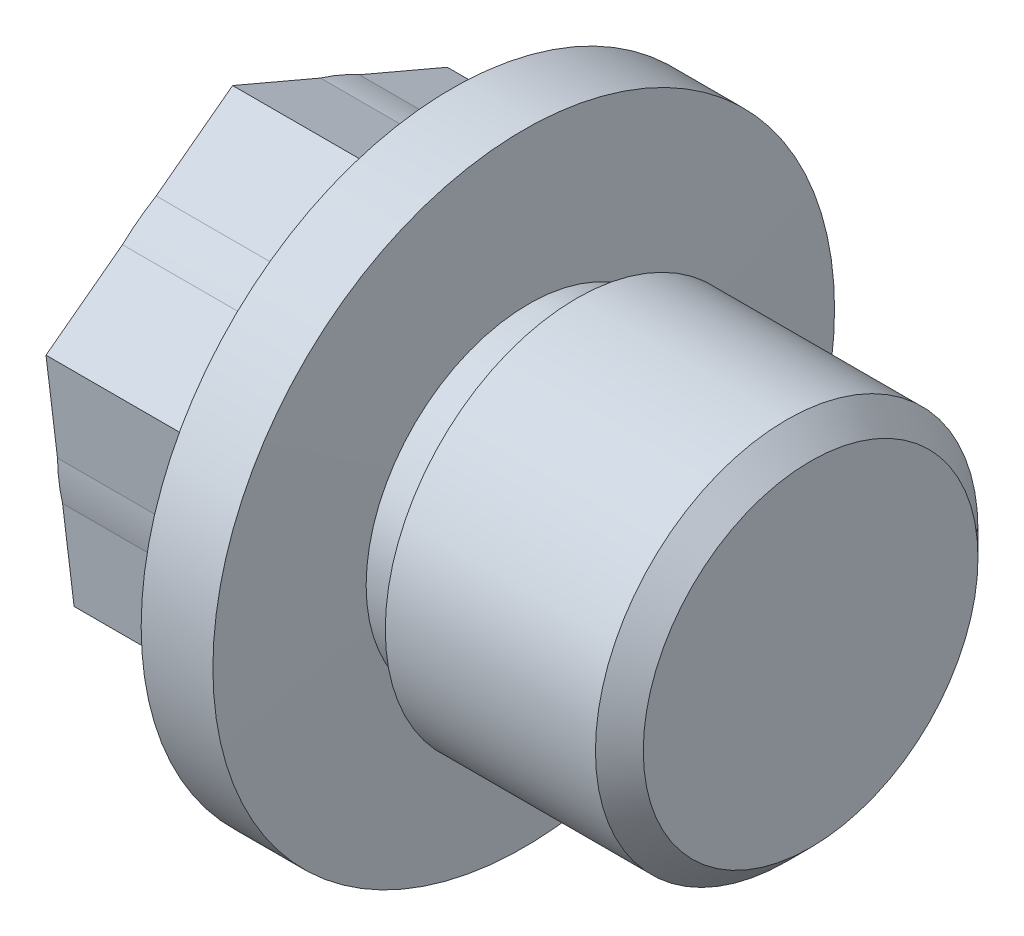
from build123d import *

# Parameters (mm, degrees)
EXTRUDE_START   = -8
SKETCH_2_R      = 8.5
EXTRUDE_1_DEPTH = 8
CHAMFER_1_SIZE  = 1


with BuildPart() as part:
    # Sketch 1 → 旋转1 (revolve)
    with BuildSketch(Plane.XY, mode=Mode.PRIVATE) as revolve_1_sk:
        Polygon((0, 0), (0, 8.5), (8, 8.5), (8, 13), (11, 13), (11.209265355, 6.8), (13.209265355, 6.8), (13.209265355, 8), (23, 8), (23, 0), align=None)
    revolve(revolve_1_sk.sketch.rotate(Axis((0, 0, 0), (1, 0, 0)), 90), axis=Axis((0, 0, 0), (1, 0, 0)))

    # 草图2 → 凸台-拉伸1 (add)
    # profile 1 of 7: a face of its own
    with BuildSketch(Plane.ZY.offset(EXTRUDE_START)):
        Polygon((-1.174764966, -9.690972033), (7.805245485, -5.86286232), (8.980010451, 3.828109713), (1.174764966, 9.690972033), (-7.805245485, 5.86286232), (-8.980010451, -3.828109713), align=None)
        Circle(SKETCH_2_R, mode=Mode.SUBTRACT)
    # profile 2 of 7: a face of its own
    with BuildSketch(Plane.ZY.offset(EXTRUDE_START)):
        with BuildLine():
            Line((-7.805245485, 5.86286232), (-8.286430908, 1.893426207))
            ThreePointArc((-8.286430908, 1.893426207), (-6.796266629, 5.104974035), (-4.12702026, 7.430861577))
            Line((-4.12702026, 7.430861577), (-7.805245485, 5.86286232))
        make_face()
    # profile 3 of 7: a face of its own
    with BuildSketch(Plane.ZY.offset(EXTRUDE_START)):
        with BuildLine():
            ThreePointArc((-2.503460259, 8.122972777), (1.022903886, 8.43822657), (4.371804767, 7.289535176))
            Line((4.371804767, 7.289535176), (1.174764966, 9.690972033))
            Line((1.174764966, 9.690972033), (-2.503460259, 8.122972777))
        make_face()
    # profile 4 of 7: a face of its own
    with BuildSketch(Plane.ZY.offset(EXTRUDE_START)):
        with BuildLine():
            ThreePointArc((8.5, 0), (8.499706252, -0.070665642), (8.498825028, -0.141326401))
            Line((8.498825028, -0.141326401), (8.980010451, 3.828109713))
            Line((8.980010451, 3.828109713), (5.78297065, 6.22954657))
            ThreePointArc((5.78297065, 6.22954657), (7.79118895, 3.398142837), (8.5, 0))
        make_face()
    # profile 5 of 7: a face of its own
    with BuildSketch(Plane.ZY.offset(EXTRUDE_START)):
        with BuildLine():
            Line((4.12702026, -7.430861577), (7.805245485, -5.86286232))
            Line((7.805245485, -5.86286232), (8.286430908, -1.893426207))
            ThreePointArc((8.286430908, -1.893426207), (6.796266629, -5.104974035), (4.12702026, -7.430861577))
        make_face()
    # profile 6 of 7: a face of its own
    with BuildSketch(Plane.ZY.offset(EXTRUDE_START)):
        with BuildLine():
            Line((-1.174764966, -9.690972033), (2.503460259, -8.122972777))
            ThreePointArc((2.503460259, -8.122972777), (-1.022903886, -8.43822657), (-4.371804767, -7.289535176))
            Line((-4.371804767, -7.289535176), (-1.174764966, -9.690972033))
        make_face()
    # profile 7 of 7: a face of its own
    with BuildSketch(Plane.ZY.offset(EXTRUDE_START)):
        with BuildLine():
            Line((-8.980010451, -3.828109713), (-5.78297065, -6.22954657))
            ThreePointArc((-5.78297065, -6.22954657), (-7.819170515, -3.333252534), (-8.498825028, 0.141326401))
            Line((-8.498825028, 0.141326401), (-8.980010451, -3.828109713))
        make_face()
    extrude(amount=EXTRUDE_1_DEPTH)

    # 倒角1
    chamfer_1_edges = [part.edges().sort_by_distance(p)[0] for p in [
        (23, 0, -8),
    ]]
    chamfer(chamfer_1_edges, length=CHAMFER_1_SIZE)


solid = part.part
